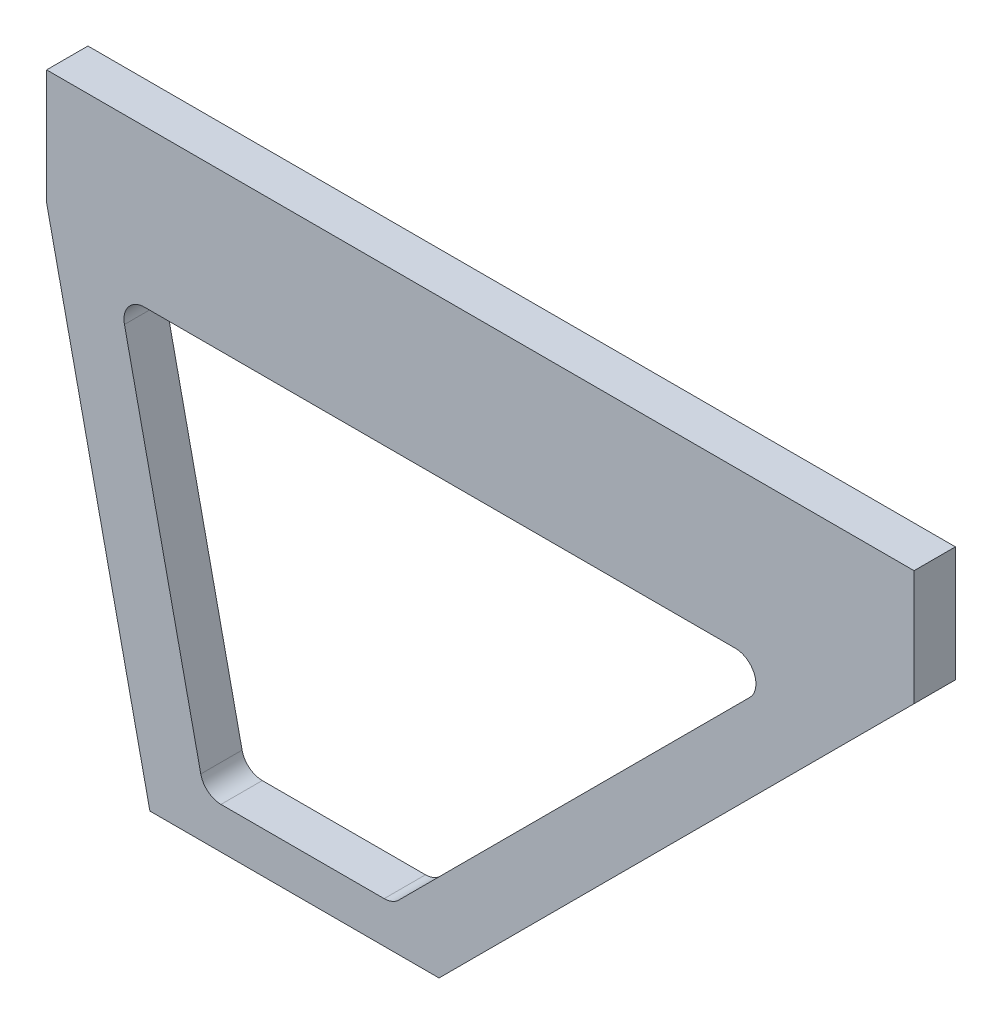
from build123d import *

# Parameters (mm, degrees)
BOSS_EXTRU_1_DEPTH = 5
FILLET1_R          = 5


with BuildPart() as part:
    # Esquisse2 → Boss.-Extru.1 (new, symmetric)
    with BuildSketch(Plane.XY):
        Polygon((-30.197209457, -50.23903484), (-5.197209457, -165.23903484), (64.802790543, -165.23903484), (179.802790543, -50.23903484), (179.802790543, -22.33903484), (-30.197209457, -22.33903484), align=None)
        Polygon((53.589587107, -155.23903484), (148.589587107, -60.23903484), (-12.672945593, -60.23903484), (7.97922832, -155.23903484), align=None, mode=Mode.SUBTRACT)
    extrude(amount=BOSS_EXTRU_1_DEPTH, both=True)

    # Fillet1
    fillet1_edges = [part.edges().sort_by_distance(p)[0] for p in [
        (7.97922832, -155.23903484, 0),
        (53.589587107, -155.23903484, 0),
        (148.589587107, -60.23903484, 0),
        (-12.672945593, -60.23903484, 0),
    ]]
    fillet(fillet1_edges, radius=FILLET1_R)


solid = part.part
